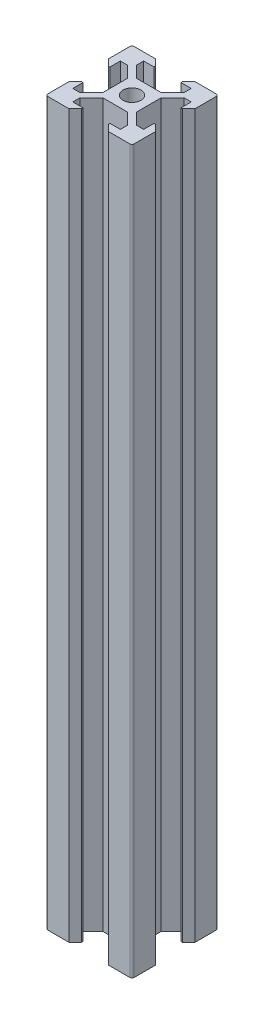
from build123d import *

# Parameters (mm, degrees)
SKETCH1_R             = 2.074585303
BOSS_EXTRUDE2_DEPTH   = 1000
CROQUIS1_W            = 21.960617296
CROQUIS1_H            = 22.681220878
CORTAR_EXTRUIR1_DEPTH = 833


with BuildPart() as part:
    # Sketch1 → Boss-Extrude2 (new body)
    with BuildSketch(Plane(origin=(0, 0, 0), x_dir=(1, 0, 0), z_dir=(0, 1, 0))):
        with BuildLine():
            Line((6.1, 12.845), (6.1, 7.149086807))
            Line((6.1, 7.149086807), (3.439339828, 4.5))
            Line((3.439339828, 4.5), (1.8, 4.5))
            Line((1.8, 4.5), (1.8, 6.88))
            Line((1.8, 6.88), (1.46, 6.88))
            Line((1.46, 6.88), (0, 5.42))
            Line((0, 5.42), (0, 0.5))
            ThreePointArc((0, 0.5), (0.146446609, 0.146446609), (0.5, 0))
            Line((0.5, 0), (5.42, 0))
            Line((5.42, 0), (6.875, 1.455))
            Line((6.875, 1.455), (6.875, 1.8))
            Line((6.875, 1.8), (4.5, 1.8))
            Line((4.5, 1.8), (4.5, 3.4393348))
            Line((4.5, 3.4393348), (7.158345795, 6.086117297))
            Line((7.158345795, 6.086117297), (7.144523479, 6.1))
            Line((7.144523479, 6.1), (12.854625295, 6.1))
            Line((12.854625295, 6.1), (12.841221344, 6.086548451))
            Line((12.841221344, 6.086548451), (15.499715, 3.437461644))
            Line((15.499715, 3.437461644), (15.5, 3.437747657))
            Line((15.5, 3.437747657), (15.5, 1.8))
            Line((15.5, 1.8), (13.12, 1.8))
            Line((13.12, 1.8), (13.12, 1.455))
            Line((13.12, 1.455), (14.575, 0))
            Line((14.575, 0), (19.5, 0))
            ThreePointArc((19.5, 0), (19.853553391, 0.146446609), (20, 0.5))
            Line((20, 0.5), (20, 5.42))
            Line((20, 5.42), (18.606904708, 6.88))
            Line((18.606904708, 6.88), (18.2, 6.88))
            Line((18.2, 6.88), (18.2, 4.5))
            Line((18.2, 4.5), (16.558493656, 4.5))
            Line((16.558493656, 4.5), (13.9, 7.149086807))
            Line((13.9, 7.149086807), (13.9, 12.844511469))
            Line((13.9, 12.844511469), (16.558493656, 15.492177728))
            Line((16.558493656, 15.492177728), (16.550703242, 15.5))
            Line((16.550703242, 15.5), (18.2, 15.5))
            Line((18.2, 15.5), (18.2, 13.12))
            Line((18.2, 13.12), (18.534428266, 13.12))
            Line((18.534428266, 13.12), (20, 14.58))
            Line((20, 14.58), (20, 19.5))
            ThreePointArc((20, 19.5), (19.853553391, 19.853553391), (19.5, 20))
            Line((19.5, 20), (14.575, 20))
            Line((14.575, 20), (13.12, 18.545))
            Line((13.12, 18.545), (13.12, 18.2))
            Line((13.12, 18.2), (15.5, 18.2))
            Line((15.5, 18.2), (15.5, 16.555))
            Line((15.5, 16.555), (12.834142613, 13.9))
            Line((12.834142613, 13.9), (7.155, 13.9))
            Line((7.155, 13.9), (4.5, 16.555))
            Line((4.5, 16.555), (4.5, 18.2))
            Line((4.5, 18.2), (6.875, 18.2))
            Line((6.875, 18.2), (6.875, 18.545))
            Line((6.875, 18.545), (5.42, 20))
            Line((5.42, 20), (0.5, 20))
            ThreePointArc((0.5, 20), (0.146446609, 19.853553391), (0, 19.5))
            Line((0, 19.5), (0, 14.58))
            Line((0, 14.58), (1.46, 13.12))
            Line((1.46, 13.12), (1.8, 13.12))
            Line((1.8, 13.12), (1.8, 15.5))
            Line((1.8, 15.5), (3.445, 15.5))
            Line((3.445, 15.5), (3.439339828, 15.494339828))
            Line((3.439339828, 15.494339828), (6.094339828, 12.839339828))
            Line((6.094339828, 12.839339828), (6.1, 12.845))
        make_face()
        with Locations((10, 10)):
            Circle(SKETCH1_R, mode=Mode.SUBTRACT)
    extrude(amount=BOSS_EXTRUDE2_DEPTH)

    # Croquis1 → Cortar-Extruir1 (cut)
    with BuildSketch(Plane(origin=(0, 1000, 0), x_dir=(1, 0, 0), z_dir=(0, 1, 0))):
        with Locations((10, 10)):
            Rectangle(CROQUIS1_W, CROQUIS1_H)
    extrude(amount=-CORTAR_EXTRUIR1_DEPTH, mode=Mode.SUBTRACT)


solid = part.part
